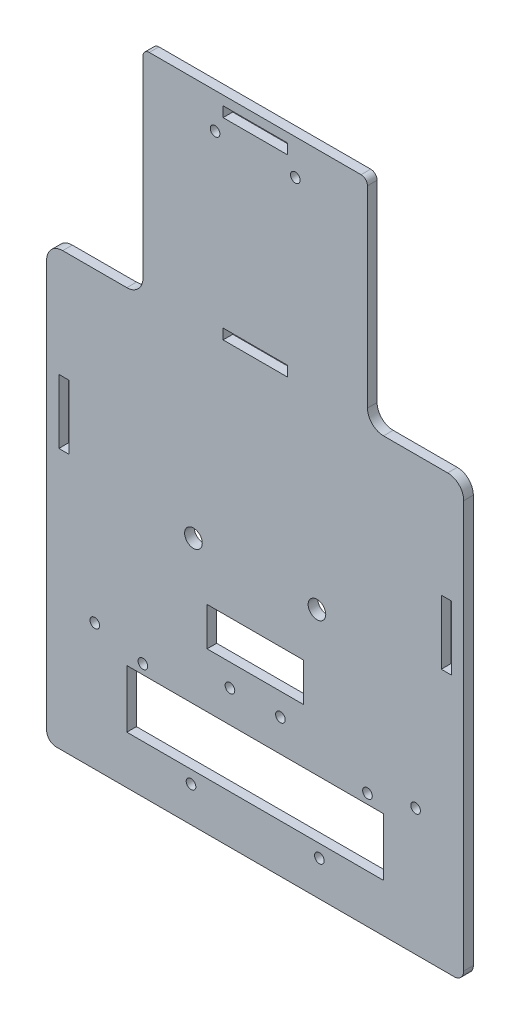
from build123d import *

# Parameters (mm, degrees)
SKETCH1_R           = 1.5
SKETCH1_R_2         = 2.75
SKETCH1_W           = 3.2
SKETCH1_H           = 20
SKETCH1_W_2         = 20
SKETCH1_H_2         = 3.2
SKETCH1_W_3         = 80
SKETCH1_H_3         = 18
SKETCH1_W_4         = 30
SKETCH1_H_4         = 12
BOSS_EXTRUDE2_DEPTH = 3


with BuildPart() as part:
    # Sketch1 → Boss-Extrude2 (new body)
    with BuildSketch(Plane.XY):
        with BuildLine():
            Line((-35, 117.25), (-35, 57.25))
            ThreePointArc((-35, 57.25), (-36.464466094, 53.714466094), (-40, 52.25))
            Line((-40, 52.25), (-60, 52.25))
            ThreePointArc((-60, 52.25), (-63.535533906, 50.785533906), (-65, 47.25))
            Line((-65, 47.25), (-65, -79.75))
            ThreePointArc((-65, -79.75), (-64.121320344, -81.871320344), (-62, -82.75))
            Line((-62, -82.75), (62, -82.75))
            ThreePointArc((62, -82.75), (64.121320344, -81.871320344), (65, -79.75))
            Line((65, -79.75), (65, 47.25))
            ThreePointArc((65, 47.25), (63.535533906, 50.785533906), (60, 52.25))
            Line((60, 52.25), (40, 52.25))
            ThreePointArc((40, 52.25), (36.464466094, 53.714466094), (35, 57.25))
            Line((35, 57.25), (35, 117.25))
            ThreePointArc((35, 117.25), (34.414213562, 118.664213562), (33, 119.25))
            Line((33, 119.25), (-33, 119.25))
            ThreePointArc((-33, 119.25), (-34.414213562, 118.664213562), (-35, 117.25))
        make_face()
        with Locations((-20, -71.75)):
            Circle(SKETCH1_R, mode=Mode.SUBTRACT)
        with Locations((20, -71.75)):
            Circle(SKETCH1_R, mode=Mode.SUBTRACT)
        with Locations((-35, -46.75)):
            Circle(SKETCH1_R, mode=Mode.SUBTRACT)
        with Locations((35, -46.75)):
            Circle(SKETCH1_R, mode=Mode.SUBTRACT)
        with Locations((-7.865, -39.75)):
            Circle(SKETCH1_R, mode=Mode.SUBTRACT)
        with Locations((7.865, -39.75)):
            Circle(SKETCH1_R, mode=Mode.SUBTRACT)
        with Locations((-19.25, -5)):
            Circle(SKETCH1_R_2, mode=Mode.SUBTRACT)
        with Locations((19.25, -5)):
            Circle(SKETCH1_R_2, mode=Mode.SUBTRACT)
        with Locations((-50, -43.25)):
            Circle(SKETCH1_R, mode=Mode.SUBTRACT)
        with Locations((50, -43.25)):
            Circle(SKETCH1_R, mode=Mode.SUBTRACT)
        with Locations((-12.5, 108.25)):
            Circle(SKETCH1_R, mode=Mode.SUBTRACT)
        with Locations((12.5, 108.25)):
            Circle(SKETCH1_R, mode=Mode.SUBTRACT)
        with Locations((59.6, 8.25)):
            Rectangle(SKETCH1_W, SKETCH1_H, mode=Mode.SUBTRACT)
        with Locations((-59.6, 8.25)):
            Rectangle(SKETCH1_W, SKETCH1_H, mode=Mode.SUBTRACT)
        with Locations((0, 54.75)):
            Rectangle(SKETCH1_W_2, SKETCH1_H_2, mode=Mode.SUBTRACT)
        with Locations((0, -58.75)):
            Rectangle(SKETCH1_W_3, SKETCH1_H_3, mode=Mode.SUBTRACT)
        with Locations((0, -26.75)):
            Rectangle(SKETCH1_W_4, SKETCH1_H_4, mode=Mode.SUBTRACT)
        with Locations((0, 114.75)):
            Rectangle(SKETCH1_W_2, SKETCH1_H_2, mode=Mode.SUBTRACT)
    extrude(amount=BOSS_EXTRUDE2_DEPTH)


solid = part.part
